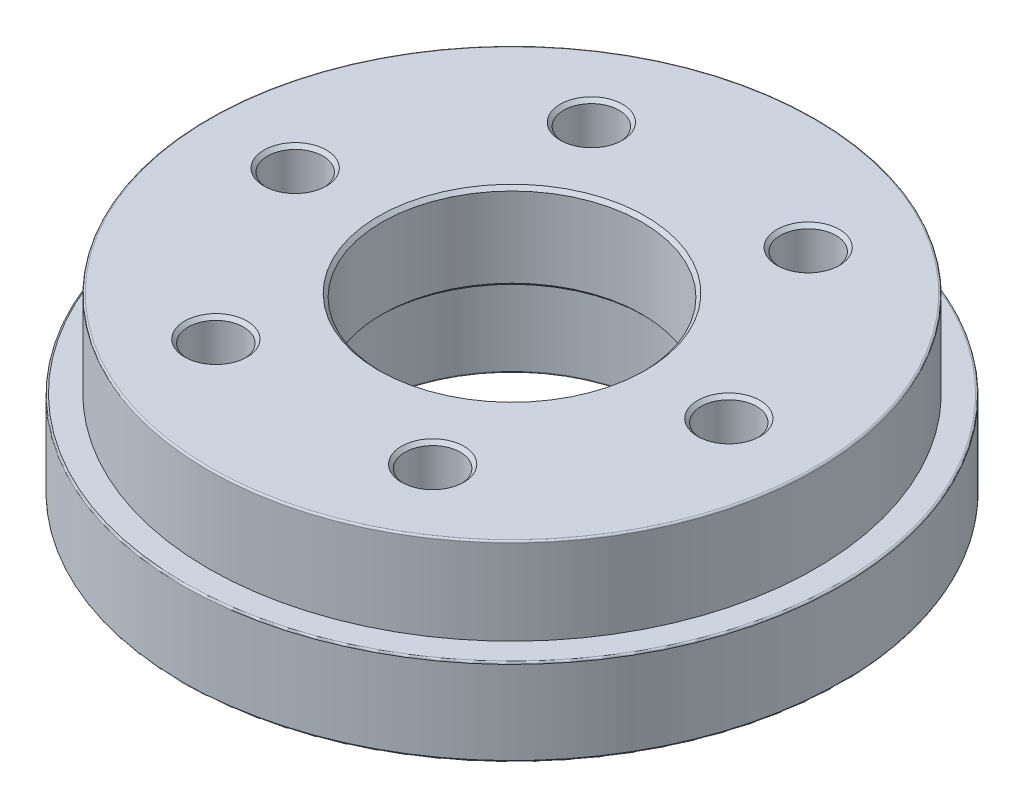
from build123d import *

# Parameters (mm, degrees)
SKETCH_1_R          = 19
EXTRUDE_1_DEPTH     = 5
SKETCH_1_3_R        = 3.1
CUT_EXTRUDE_1_DEPTH = 4
SKETCH_5_R          = 17.5
EXTRUDE_3_DEPTH     = 5
SKETCH_7_R          = 8.5
CUT_EXTRUDE_2_DEPTH = 5
SKETCH_8_R          = 7.5
CUT_EXTRUDE_3_DEPTH = 0.5
CUT_EXTRUDE_4_REACH = 30.671
SKETCH_10_R         = 1.6
CUT_EXTRUDE_5_DEPTH = 3
CUT_EXTRUDE_6_REACH = 30.671
SKETCH_12_R         = 7.5
CHAMFER_1_SIZE      = 0.2
FILLET_1_R          = 0.1
FILLET_2_R          = 0.1


with BuildPart() as part:
    # 草图1 → 凸台-拉伸1 (new body)
    with BuildSketch(Plane(origin=(0, 0, 0), x_dir=(1, 0, 0), z_dir=(0, 1, 0))):
        Circle(SKETCH_1_R)
    extrude(amount=EXTRUDE_1_DEPTH)

    # 草图1<3> → 切除-拉伸1 (cut)
    with BuildSketch(Plane(origin=(0, 0, 0), x_dir=(1, 0, 0), z_dir=(0, 1, 0))):
        with Locations((0, 15)):
            Circle(SKETCH_1_3_R)
        with Locations((12.990381057, 7.5)):
            Circle(SKETCH_1_3_R)
        with Locations((12.990381057, -7.5)):
            Circle(SKETCH_1_3_R)
        with Locations((0, -15)):
            Circle(SKETCH_1_3_R)
        with Locations((-12.990381057, -7.5)):
            Circle(SKETCH_1_3_R)
        with Locations((-12.990381057, 7.5)):
            Circle(SKETCH_1_3_R)
    extrude(amount=CUT_EXTRUDE_1_DEPTH, mode=Mode.SUBTRACT)

    # 草图5 → 凸台-拉伸3 (add)
    with BuildSketch(Plane(origin=(0, 5, 0), x_dir=(1, 0, 0), z_dir=(0, 1, 0))):
        Circle(SKETCH_5_R)
    extrude(amount=EXTRUDE_3_DEPTH)

    # 草图7 → 切除-拉伸2 (cut)
    with BuildSketch(Plane.XZ):
        Circle(SKETCH_7_R)
    extrude(amount=-CUT_EXTRUDE_2_DEPTH, mode=Mode.SUBTRACT)

    # 草图8 → 切除-拉伸3 (cut)
    with BuildSketch(Plane.XZ.offset(-5)):
        Circle(SKETCH_8_R)
    extrude(amount=-CUT_EXTRUDE_3_DEPTH, mode=Mode.SUBTRACT)

    # 草图10 → 切除-拉伸4 (cut, up to next)
    with BuildSketch(Plane.XZ, mode=Mode.PRIVATE) as cut_extrude_4_sk1:
        with Locations((6.25, 10.825317547)):
            Circle(SKETCH_10_R)
    cut_extrude_4_tool1 = extrude(cut_extrude_4_sk1.sketch, amount=-CUT_EXTRUDE_4_REACH, mode=Mode.PRIVATE) & part.part
    # 草图10 → 切除-拉伸4 (cut, up to next)
    with BuildSketch(Plane.XZ, mode=Mode.PRIVATE) as cut_extrude_4_sk2:
        with Locations((12.5, 0)):
            Circle(SKETCH_10_R)
    cut_extrude_4_tool2 = extrude(cut_extrude_4_sk2.sketch, amount=-CUT_EXTRUDE_4_REACH, mode=Mode.PRIVATE) & part.part
    # 草图10 → 切除-拉伸4 (cut, up to next)
    with BuildSketch(Plane.XZ, mode=Mode.PRIVATE) as cut_extrude_4_sk3:
        with Locations((6.25, -10.825317547)):
            Circle(SKETCH_10_R)
    cut_extrude_4_tool3 = extrude(cut_extrude_4_sk3.sketch, amount=-CUT_EXTRUDE_4_REACH, mode=Mode.PRIVATE) & part.part
    # 草图10 → 切除-拉伸4 (cut, up to next)
    with BuildSketch(Plane.XZ, mode=Mode.PRIVATE) as cut_extrude_4_sk4:
        with Locations((-6.25, -10.825317547)):
            Circle(SKETCH_10_R)
    cut_extrude_4_tool4 = extrude(cut_extrude_4_sk4.sketch, amount=-CUT_EXTRUDE_4_REACH, mode=Mode.PRIVATE) & part.part
    # 草图10 → 切除-拉伸4 (cut, up to next)
    with BuildSketch(Plane.XZ, mode=Mode.PRIVATE) as cut_extrude_4_sk5:
        with Locations((-12.5, 0)):
            Circle(SKETCH_10_R)
    cut_extrude_4_tool5 = extrude(cut_extrude_4_sk5.sketch, amount=-CUT_EXTRUDE_4_REACH, mode=Mode.PRIVATE) & part.part
    # 草图10 → 切除-拉伸4 (cut, up to next)
    with BuildSketch(Plane.XZ, mode=Mode.PRIVATE) as cut_extrude_4_sk6:
        with Locations((-6.25, 10.825317547)):
            Circle(SKETCH_10_R)
    cut_extrude_4_tool6 = extrude(cut_extrude_4_sk6.sketch, amount=-CUT_EXTRUDE_4_REACH, mode=Mode.PRIVATE) & part.part
    add(cut_extrude_4_tool1.solids().sort_by_distance((6.25, 0, 10.825318))[0], mode=Mode.SUBTRACT)
    add(cut_extrude_4_tool2.solids().sort_by_distance((12.5, 0, 0))[0], mode=Mode.SUBTRACT)
    add(cut_extrude_4_tool3.solids().sort_by_distance((6.25, 0, -10.825318))[0], mode=Mode.SUBTRACT)
    add(cut_extrude_4_tool4.solids().sort_by_distance((-6.25, 0, -10.825318))[0], mode=Mode.SUBTRACT)
    add(cut_extrude_4_tool5.solids().sort_by_distance((-12.5, 0, 0))[0], mode=Mode.SUBTRACT)
    add(cut_extrude_4_tool6.solids().sort_by_distance((-6.25, 0, 10.825318))[0], mode=Mode.SUBTRACT)

    # 草图11 → 切除-拉伸5 (cut)
    with BuildSketch(Plane.XZ):
        Polygon((6.25, -14.000744028), (9, -12.413030788), (9, -9.237604307), (6.25, -7.649891067), (3.5, -9.237604307), (3.5, -12.413030788), align=None)
        Polygon((15.25, -1.58771324), (15.25, 1.58771324), (12.5, 3.175426481), (9.75, 1.58771324), (9.75, -1.58771324), (12.5, -3.175426481), align=None)
        Polygon((-9, -12.413030788), (-6.25, -14.000744028), (-3.5, -12.413030788), (-3.5, -9.237604307), (-6.25, -7.649891067), (-9, -9.237604307), align=None)
        Polygon((-15.25, 1.58771324), (-15.25, -1.58771324), (-12.5, -3.175426481), (-9.75, -1.58771324), (-9.75, 1.58771324), (-12.5, 3.175426481), align=None)
        Polygon((-6.25, 14.000744028), (-9, 12.413030788), (-9, 9.237604307), (-6.25, 7.649891067), (-3.5, 9.237604307), (-3.5, 12.413030788), align=None)
        Polygon((9, 12.413030788), (6.25, 14.000744028), (3.5, 12.413030788), (3.5, 9.237604307), (6.25, 7.649891067), (9, 9.237604307), align=None)
    extrude(amount=-CUT_EXTRUDE_5_DEPTH, mode=Mode.SUBTRACT)

    # 草图12 → 切除-拉伸6 (cut, up to next)
    with BuildSketch(Plane(origin=(0, 10, 0), x_dir=(1, 0, 0), z_dir=(0, 1, 0)), mode=Mode.PRIVATE) as cut_extrude_6_sk1:
        Circle(SKETCH_12_R)
    cut_extrude_6_tool1 = extrude(cut_extrude_6_sk1.sketch, amount=-CUT_EXTRUDE_6_REACH, mode=Mode.PRIVATE) & part.part
    add(cut_extrude_6_tool1.solids().sort_by_distance((0, 10, 0))[0], mode=Mode.SUBTRACT)

    # 倒角1
    chamfer_1_edges = [part.edges().sort_by_distance(p)[0] for p in [
        (-14.1, 3, 0),
        (-14.1, 10, 0),
        (-7.85, 3, 10.825317547),
        (-7.85, 10, 10.825317547),
        (4.65, 3, 10.825317547),
        (4.65, 10, 10.825317547),
        (10.9, 3, 0),
        (10.9, 10, 0),
        (4.65, 3, -10.825317547),
        (4.65, 10, -10.825317547),
        (-7.85, 3, -10.825317547),
        (-7.85, 10, -10.825317547),
        (-7.5, 10, 0),
        (-7.5, 5, 0),
    ]]
    chamfer(chamfer_1_edges, length=CHAMFER_1_SIZE)

    # 圆角1
    fillet_1_edges = [part.edges().sort_by_distance(p)[0] for p in [
        (-19, 0, 0),
        (-19, 5, 0),
        (-8.5, 0, 0),
        (-17.5, 10, 0),
    ]]
    fillet(fillet_1_edges, radius=FILLET_1_R)

    # 圆角2
    fillet_2_edges = [part.edges().sort_by_distance(p)[0] for p in [
        (9.890381057, 0, 7.5),
        (9.890381057, 0, -7.5),
        (-3.1, 0, -15),
        (-16.090381057, 0, -7.5),
        (-16.090381057, 0, 7.5),
        (-3.1, 0, 15),
    ]]
    fillet(fillet_2_edges, radius=FILLET_2_R)


solid = part.part
